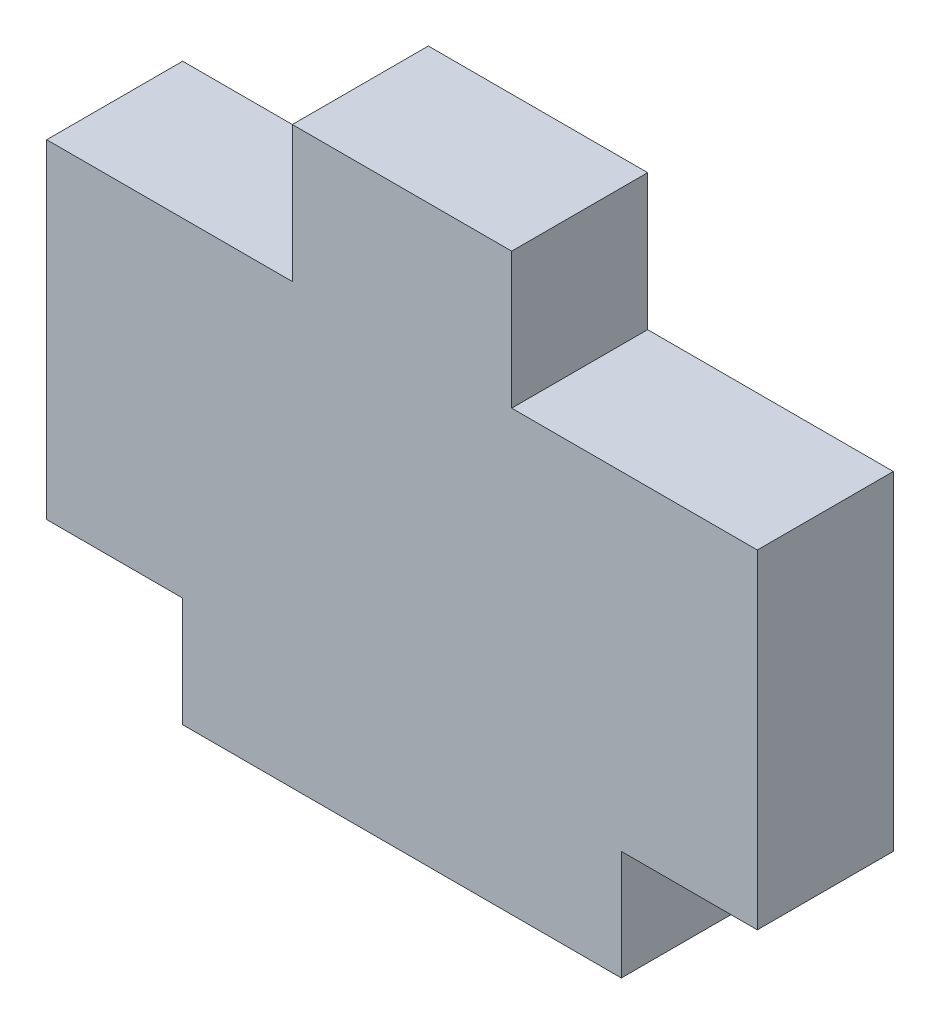
from build123d import *

# Parameters (mm, degrees)
BOSS_EXTRUDE1_DEPTH = 12.4


with BuildPart() as part:
    # Model → Boss-Extrude1 (new body)
    with BuildSketch(Plane.XY):
        Polygon((10, 40), (32.4, 40), (32.4, 10), (20, 10), (20, 0), (-20, 0), (-20, 10), (-32.4, 10), (-32.4, 40), (-10, 40), (-10, 52.4), (10, 52.4), align=None)
    extrude(amount=BOSS_EXTRUDE1_DEPTH)


solid = part.part
